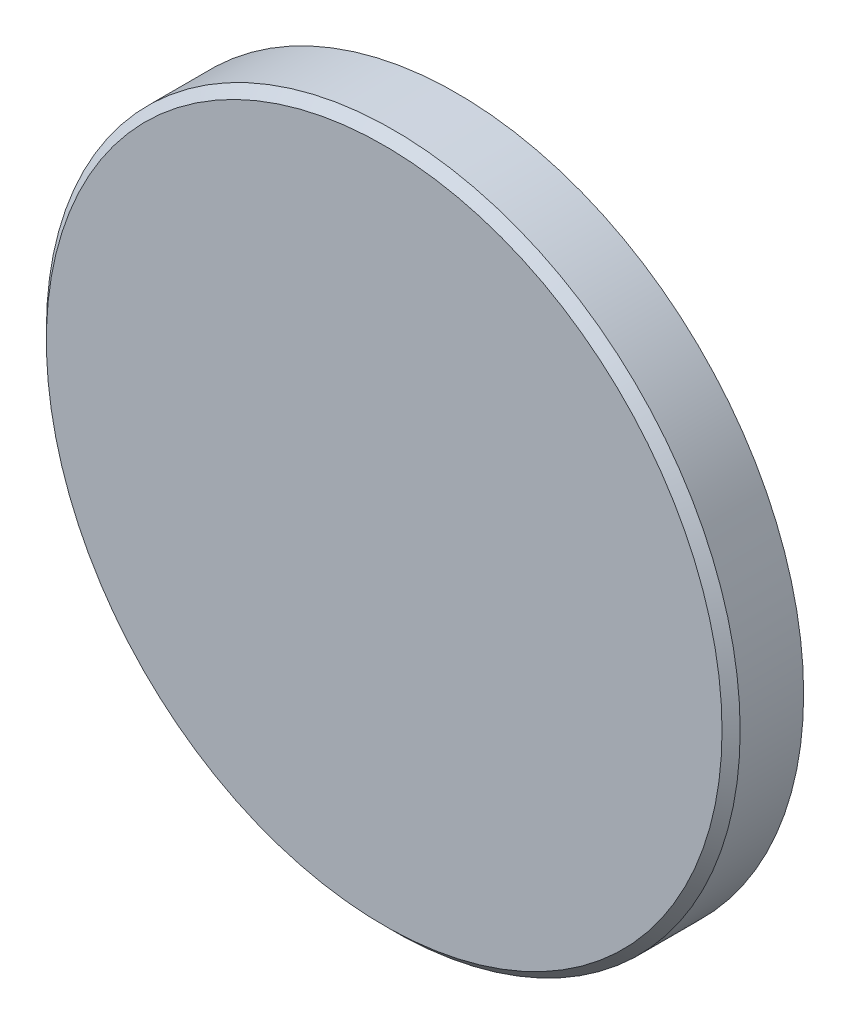
from build123d import *

# Parameters (mm, degrees)
SKETCH1_R           = 9.564659965
BOSS_EXTRUDE1_DEPTH = 2
CHAMFER1_SIZE       = 0.25


with BuildPart() as part:
    # Sketch1 → Boss-Extrude1 (new body)
    with BuildSketch(Plane.XY):
        Circle(SKETCH1_R)
    extrude(amount=-BOSS_EXTRUDE1_DEPTH)

    # Chamfer1
    chamfer1_edges = [part.edges().sort_by_distance(p)[0] for p in [
        (-9.564659965, 0, 0),
    ]]
    chamfer(chamfer1_edges, length=CHAMFER1_SIZE)


solid = part.part
